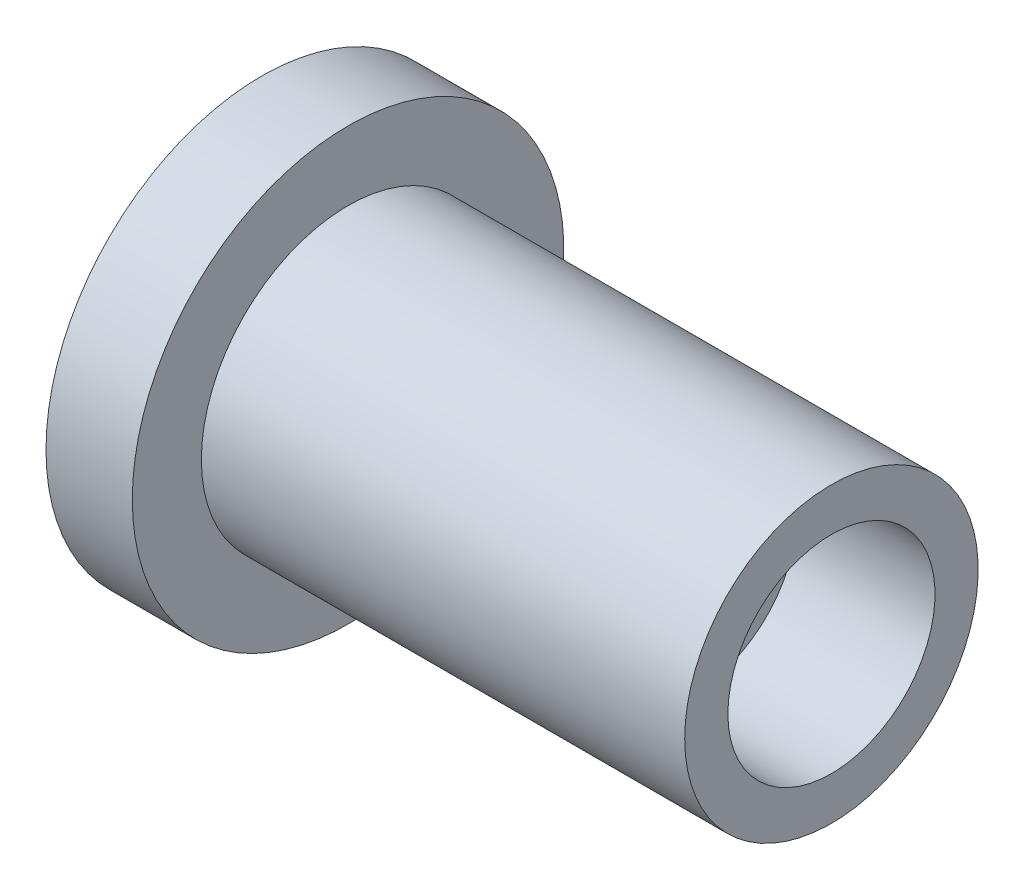
from build123d import *


with BuildPart() as part:
    # Эскиз1 → Повернуть1 (revolve)
    with BuildSketch(Plane.XY, mode=Mode.PRIVATE) as revolve_1_sk:
        Polygon((0, 0), (0, 6), (2, 6), (2, 12.5), (7, 12.5), (7, 8.5), (35, 8.5), (35, 6), (27, 6), (27, 0), align=None)
    revolve(revolve_1_sk.sketch.rotate(Axis((0, 0, 0), (1, 0, 0)), 90), axis=Axis((0, 0, 0), (1, 0, 0)))


solid = part.part
